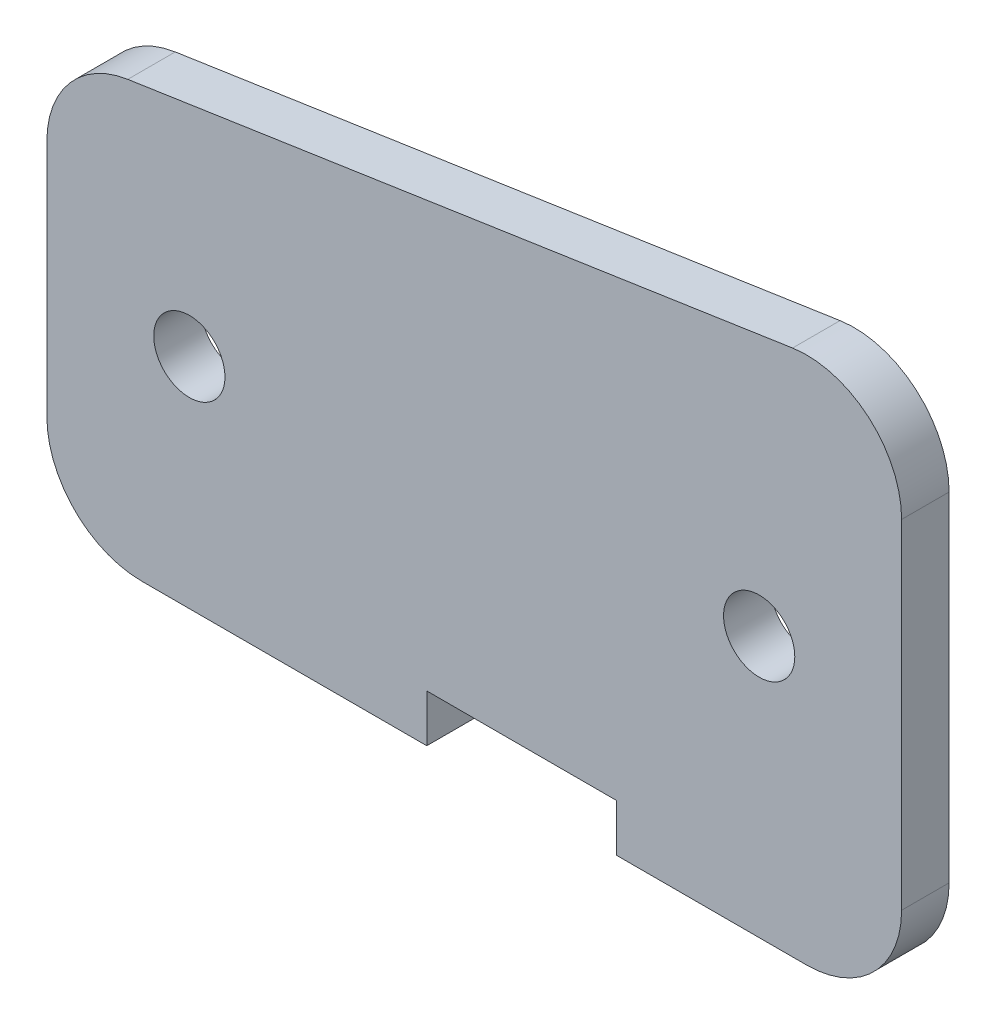
from build123d import *

# Parameters (mm, degrees)
BOSS_EXTRUDE1_DEPTH = 3.175


with BuildPart() as part:
    # Sketch1 → Boss-Extrude1 (new body)
    with BuildSketch(Plane.XY):
        with BuildLine():
            Line((-231.775, 0), (-228.6, 0))
            Line((-228.6, 0), (-228.6, 12.22375))
            ThreePointArc((-228.6, 12.22375), (-230.98125, 14.605), (-228.6, 16.98625))
            Line((-228.6, 16.98625), (-228.6, 29.21))
            Line((-228.6, 29.21), (-232.716961876, 28.592455719))
            ThreePointArc((-232.716961876, 28.592455719), (-236.586650336, 26.456442621), (-238.125, 22.312709878))
            Line((-238.125, 22.312709878), (-238.125, 6.35))
            ThreePointArc((-238.125, 6.35), (-236.265128061, 1.859871939), (-231.775, 0))
        make_face()
        with BuildLine():
            Line((-228.6, 0), (-212.725, 0))
            Line((-212.725, 0), (-212.725, 3.175))
            Line((-212.725, 3.175), (-200.025, 3.175))
            Line((-200.025, 3.175), (-200.025, 0))
            Line((-200.025, 0), (-190.5, 0))
            Line((-190.5, 0), (-190.5, 15.08125))
            ThreePointArc((-190.5, 15.08125), (-192.88125, 17.4625), (-190.5, 19.84375))
            Line((-190.5, 19.84375), (-190.5, 34.925))
            Line((-190.5, 34.925), (-228.6, 29.21))
            Line((-228.6, 29.21), (-228.6, 16.98625))
            ThreePointArc((-228.6, 16.98625), (-226.916201977, 16.288798023), (-226.21875, 14.605))
            ThreePointArc((-226.21875, 14.605), (-226.916201977, 12.921201977), (-228.6, 12.22375))
            Line((-228.6, 12.22375), (-228.6, 0))
        make_face()
        with BuildLine():
            Line((-190.5, 15.08125), (-190.5, 0))
            Line((-190.5, 0), (-187.325, 0))
            ThreePointArc((-187.325, 0), (-182.834871939, 1.859871939), (-180.975, 6.35))
            Line((-180.975, 6.35), (-180.975, 28.980209878))
            ThreePointArc((-180.975, 28.980209878), (-183.181267257, 33.791860214), (-188.266961876, 35.259955719))
            Line((-188.266961876, 35.259955719), (-190.5, 34.925))
            Line((-190.5, 34.925), (-190.5, 19.84375))
            ThreePointArc((-190.5, 19.84375), (-188.816201977, 19.146298023), (-188.11875, 17.4625))
            ThreePointArc((-188.11875, 17.4625), (-188.816201977, 15.778701977), (-190.5, 15.08125))
        make_face()
    extrude(amount=BOSS_EXTRUDE1_DEPTH)


solid = part.part
